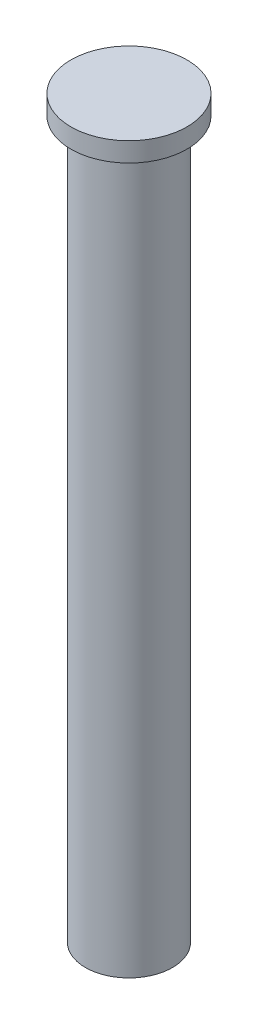
from build123d import *


with BuildPart() as part:
    # Sketch2 → Base-Revolve (revolve)
    with BuildSketch(Plane.XY, mode=Mode.PRIVATE) as base_revolve_sk:
        Polygon((0, 90), (0, -290), (22.5, -290), (22.5, 80), (30, 80), (30, 90), align=None)
    revolve(base_revolve_sk.sketch.rotate(Axis((0, 90, 0), (0, -1, 0)), 180), axis=Axis((0, 90, 0), (0, -1, 0)))


solid = part.part
